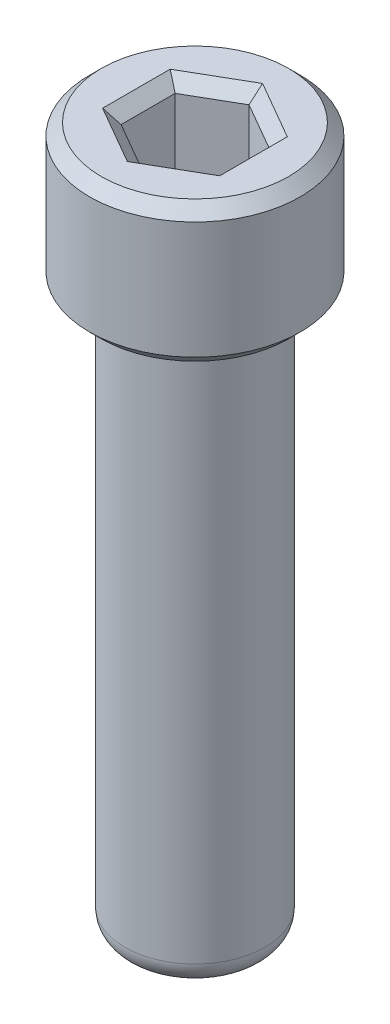
from build123d import *

# Parameters (mm, degrees)
SKETCH1_R           = 1.5
BOSS_EXTRUDE1_DEPTH = 12
SKETCH2_R           = 2.25
BOSS_EXTRUDE2_DEPTH = 3
CUT_EXTRUDE1_DEPTH  = 2
CHAMFER1_SIZE       = 0.25
FILLET1_R           = 0.5


with BuildPart() as part:
    # Sketch1 → Boss-Extrude1 (new body)
    with BuildSketch(Plane(origin=(0, 0, 0), x_dir=(1, 0, 0), z_dir=(0, 1, 0))):
        with Locations(Location((0, 0, 0), (0, 0, 270))):
            Circle(SKETCH1_R)
    extrude(amount=BOSS_EXTRUDE1_DEPTH)

    # Sketch2 → Boss-Extrude2 (add)
    with BuildSketch(Plane(origin=(0, 12, 0), x_dir=(1, 0, 0), z_dir=(0, 1, 0))):
        with Locations(Location((0, 0, 0), (0, 0, 270))):
            Circle(SKETCH2_R)
    extrude(amount=BOSS_EXTRUDE2_DEPTH)

    # Sketch3 → Cut-Extrude1 (cut)
    with BuildSketch(Plane(origin=(0, 15, 0), x_dir=(1, 0, 0), z_dir=(0, 1, 0))):
        Polygon((0, 1.154700538), (-1, 0.577350269), (-1, -0.577350269), (0, -1.154700538), (1, -0.577350269), (1, 0.577350269), align=None)
    extrude(amount=-CUT_EXTRUDE1_DEPTH, mode=Mode.SUBTRACT)

    # Chamfer1
    chamfer1_edges = [part.edges().sort_by_distance(p)[0] for p in [
        (0.5, 15, -0.866025404),
        (-0.5, 15, -0.866025404),
        (-1, 15, 0),
        (-0.5, 15, 0.866025404),
        (0.5, 15, 0.866025404),
        (1, 15, 0),
        (0, 12, -2.25),
        (0, 15, -2.25),
    ]]
    chamfer(chamfer1_edges, length=CHAMFER1_SIZE)

    # Fillet1
    fillet1_edges = [part.edges().sort_by_distance(p)[0] for p in [
        (0, 0, -1.5),
    ]]
    fillet(fillet1_edges, radius=FILLET1_R)


solid = part.part
